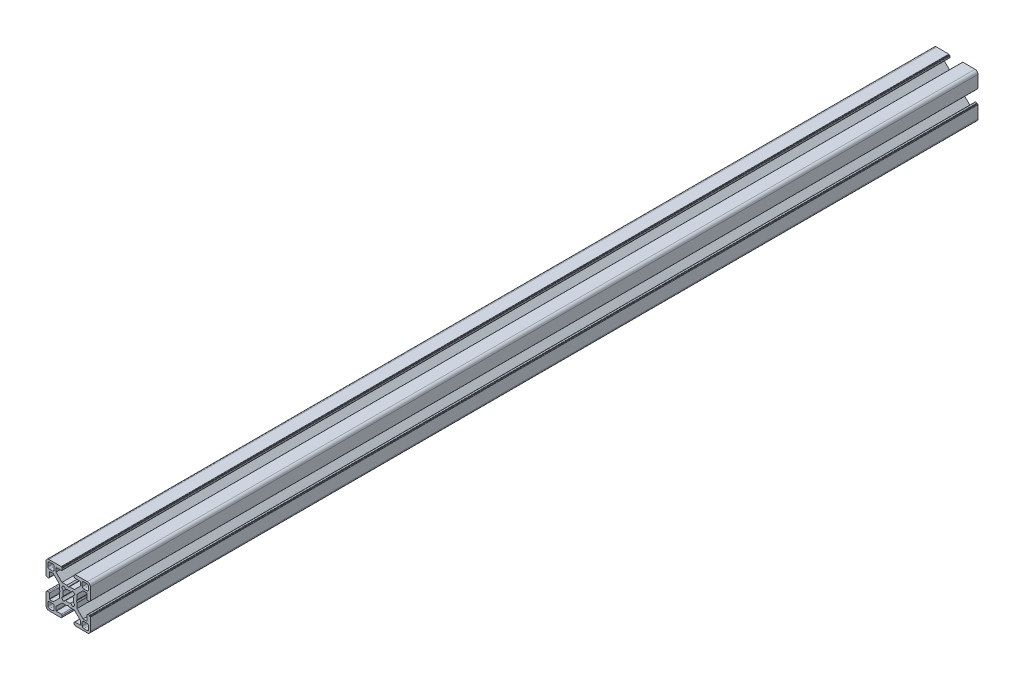
from build123d import *

# Parameters (mm, degrees)
BOSS_EXTRUDE1_DEPTH = 600
SKETCH2_R           = 3
CUT_EXTRUDE1_DEPTH  = 576.977430113


with BuildPart() as part:
    # Sketch1 → Boss-Extrude1 (new body)
    with BuildSketch(Plane.XY.offset(25)):
        with BuildLine():
            Line((-4.05, 13.399999434), (-4.05, 14.299999626))
            ThreePointArc((-4.05, 14.299999626), (-4.108578753, 14.441421247), (-4.250000374, 14.5))
            Line((-4.250000374, 14.5), (-4.350000144, 14.5))
            ThreePointArc((-4.350000144, 14.5), (-4.49142109, 14.558578474), (-4.549999564, 14.69999942))
            Line((-4.549999564, 14.69999942), (-4.549999564, 14.799999619))
            ThreePointArc((-4.549999564, 14.799999619), (-4.60857832, 14.941421245), (-4.749999945, 15))
            Line((-4.749999945, 15), (-13.000000346, 15))
            ThreePointArc((-13.000000346, 15), (-14.414213664, 14.414213664), (-15, 13.000000346))
            Line((-15, 13.000000346), (-15, 4.749999521))
            ThreePointArc((-15, 4.749999521), (-14.941421273, 4.608577964), (-14.799999716, 4.549999237))
            Line((-14.799999716, 4.549999237), (-14.700000611, 4.549999237))
            ThreePointArc((-14.700000611, 4.549999237), (-14.558579054, 4.49142051), (-14.500000327, 4.349998953))
            Line((-14.500000327, 4.349998953), (-14.500000327, 4.249999521))
            ThreePointArc((-14.500000327, 4.249999521), (-14.4414216, 4.108577964), (-14.300000043, 4.049999237))
            Line((-14.300000043, 4.049999237), (-13.39999994, 4.049999237))
            ThreePointArc((-13.39999994, 4.049999237), (-12.975735606, 4.225735278), (-12.799999564, 4.649999613))
            Line((-12.799999564, 4.649999613), (-12.799999564, 8.049999716))
            ThreePointArc((-12.799999564, 8.049999716), (-12.741420837, 8.191421273), (-12.59999928, 8.25))
            Line((-12.59999928, 8.25), (-10.049999564, 8.25))
            Line((-10.049999564, 8.25), (-6.00446543, 4.204465866))
            Line((-6.00446543, 4.204465866), (-6.00446543, 0.899999619))
            Line((-6.00446543, 0.899999619), (-5.484852164, 0))
            Line((-5.484852164, 0), (-6.00446543, -0.899999619))
            Line((-6.00446543, -0.899999619), (-6.00446543, -4.204465866))
            Line((-6.00446543, -4.204465866), (-10.049999564, -8.25))
            Line((-10.049999564, -8.25), (-12.59999928, -8.25))
            ThreePointArc((-12.59999928, -8.25), (-12.741420837, -8.191421273), (-12.799999564, -8.049999716))
            Line((-12.799999564, -8.049999716), (-12.799999564, -4.649999613))
            ThreePointArc((-12.799999564, -4.649999613), (-12.975735606, -4.225735278), (-13.39999994, -4.049999237))
            Line((-13.39999994, -4.049999237), (-14.300000043, -4.049999237))
            ThreePointArc((-14.300000043, -4.049999237), (-14.4414216, -4.108577964), (-14.500000327, -4.249999521))
            Line((-14.500000327, -4.249999521), (-14.500000327, -4.349998953))
            ThreePointArc((-14.500000327, -4.349998953), (-14.558579054, -4.49142051), (-14.700000611, -4.549999237))
            Line((-14.700000611, -4.549999237), (-14.799999716, -4.549999237))
            ThreePointArc((-14.799999716, -4.549999237), (-14.941421273, -4.608577964), (-15, -4.749999521))
            Line((-15, -4.749999521), (-15, -13.000000346))
            ThreePointArc((-15, -13.000000346), (-14.414213664, -14.414213664), (-13.000000346, -15))
            Line((-13.000000346, -15), (-4.749999945, -15))
            ThreePointArc((-4.749999945, -15), (-4.60857832, -14.941421245), (-4.549999564, -14.799999619))
            Line((-4.549999564, -14.799999619), (-4.549999564, -14.69999942))
            ThreePointArc((-4.549999564, -14.69999942), (-4.49142109, -14.558578474), (-4.350000144, -14.5))
            Line((-4.350000144, -14.5), (-4.250000374, -14.5))
            ThreePointArc((-4.250000374, -14.5), (-4.108578753, -14.441421247), (-4.05, -14.299999626))
            Line((-4.05, -14.299999626), (-4.05, -13.399999434))
            ThreePointArc((-4.05, -13.399999434), (-4.225735989, -12.975735226), (-4.650000197, -12.799999237))
            Line((-4.650000197, -12.799999237), (-8.049999924, -12.799999237))
            ThreePointArc((-8.049999924, -12.799999237), (-8.191421565, -12.741420475), (-8.250000327, -12.599998834))
            Line((-8.250000327, -12.599998834), (-8.250000327, -10.049999237))
            Line((-8.250000327, -10.049999237), (-4.204466193, -6))
            Line((-4.204466193, -6), (-0.899999946, -6))
            Line((-0.899999946, -6), (0, -5.484851837))
            Line((0, -5.484851837), (0.899999946, -6))
            Line((0.899999946, -6), (4.204466193, -6))
            Line((4.204466193, -6), (8.250000327, -10.049999237))
            Line((8.250000327, -10.049999237), (8.250000327, -12.599998834))
            ThreePointArc((8.250000327, -12.599998834), (8.191421565, -12.741420475), (8.049999924, -12.799999237))
            Line((8.049999924, -12.799999237), (4.650000197, -12.799999237))
            ThreePointArc((4.650000197, -12.799999237), (4.225735989, -12.975735226), (4.05, -13.399999434))
            Line((4.05, -13.399999434), (4.05, -14.299999626))
            ThreePointArc((4.05, -14.299999626), (4.108578753, -14.441421247), (4.250000374, -14.5))
            Line((4.250000374, -14.5), (4.350000144, -14.5))
            ThreePointArc((4.350000144, -14.5), (4.49142109, -14.558578474), (4.549999564, -14.69999942))
            Line((4.549999564, -14.69999942), (4.549999564, -14.799999619))
            ThreePointArc((4.549999564, -14.799999619), (4.60857832, -14.941421245), (4.749999945, -15))
            Line((4.749999945, -15), (13.000000346, -15))
            ThreePointArc((13.000000346, -15), (14.414213664, -14.414213664), (15, -13.000000346))
            Line((15, -13.000000346), (15, -4.749999521))
            ThreePointArc((15, -4.749999521), (14.941421273, -4.608577964), (14.799999716, -4.549999237))
            Line((14.799999716, -4.549999237), (14.700000611, -4.549999237))
            ThreePointArc((14.700000611, -4.549999237), (14.558579054, -4.49142051), (14.500000327, -4.349998953))
            Line((14.500000327, -4.349998953), (14.500000327, -4.249999521))
            ThreePointArc((14.500000327, -4.249999521), (14.4414216, -4.108577964), (14.300000043, -4.049999237))
            Line((14.300000043, -4.049999237), (13.39999994, -4.049999237))
            ThreePointArc((13.39999994, -4.049999237), (12.975735606, -4.225735278), (12.799999564, -4.649999613))
            Line((12.799999564, -4.649999613), (12.799999564, -8.049999716))
            ThreePointArc((12.799999564, -8.049999716), (12.741420837, -8.191421273), (12.59999928, -8.25))
            Line((12.59999928, -8.25), (10.049999564, -8.25))
            Line((10.049999564, -8.25), (6.00446543, -4.204465866))
            Line((6.00446543, -4.204465866), (6.00446543, -0.899999619))
            Line((6.00446543, -0.899999619), (5.484852164, 0))
            Line((5.484852164, 0), (6.00446543, 0.899999619))
            Line((6.00446543, 0.899999619), (6.00446543, 4.204465866))
            Line((6.00446543, 4.204465866), (10.049999564, 8.25))
            Line((10.049999564, 8.25), (12.59999928, 8.25))
            ThreePointArc((12.59999928, 8.25), (12.741420837, 8.191421273), (12.799999564, 8.049999716))
            Line((12.799999564, 8.049999716), (12.799999564, 4.649999613))
            ThreePointArc((12.799999564, 4.649999613), (12.975735606, 4.225735278), (13.39999994, 4.049999237))
            Line((13.39999994, 4.049999237), (14.300000043, 4.049999237))
            ThreePointArc((14.300000043, 4.049999237), (14.4414216, 4.108577964), (14.500000327, 4.249999521))
            Line((14.500000327, 4.249999521), (14.500000327, 4.349998953))
            ThreePointArc((14.500000327, 4.349998953), (14.558579054, 4.49142051), (14.700000611, 4.549999237))
            Line((14.700000611, 4.549999237), (14.799999716, 4.549999237))
            ThreePointArc((14.799999716, 4.549999237), (14.941421273, 4.608577964), (15, 4.749999521))
            Line((15, 4.749999521), (15, 13.000000346))
            ThreePointArc((15, 13.000000346), (14.414213664, 14.414213664), (13.000000346, 15))
            Line((13.000000346, 15), (4.749999945, 15))
            ThreePointArc((4.749999945, 15), (4.60857832, 14.941421245), (4.549999564, 14.799999619))
            Line((4.549999564, 14.799999619), (4.549999564, 14.69999942))
            ThreePointArc((4.549999564, 14.69999942), (4.49142109, 14.558578474), (4.350000144, 14.5))
            Line((4.350000144, 14.5), (4.250000374, 14.5))
            ThreePointArc((4.250000374, 14.5), (4.108578753, 14.441421247), (4.05, 14.299999626))
            Line((4.05, 14.299999626), (4.05, 13.399999434))
            ThreePointArc((4.05, 13.399999434), (4.225735989, 12.975735226), (4.650000197, 12.799999237))
            Line((4.650000197, 12.799999237), (8.049999924, 12.799999237))
            ThreePointArc((8.049999924, 12.799999237), (8.191421565, 12.741420475), (8.250000327, 12.599998834))
            Line((8.250000327, 12.599998834), (8.250000327, 10.049999237))
            Line((8.250000327, 10.049999237), (4.204466193, 6))
            Line((4.204466193, 6), (0.899999946, 6))
            Line((0.899999946, 6), (0, 5.484851837))
            Line((0, 5.484851837), (-0.899999946, 6))
            Line((-0.899999946, 6), (-4.204466193, 6))
            Line((-4.204466193, 6), (-8.250000327, 10.049999237))
            Line((-8.250000327, 10.049999237), (-8.250000327, 12.599998834))
            ThreePointArc((-8.250000327, 12.599998834), (-8.191421565, 12.741420475), (-8.049999924, 12.799999237))
            Line((-8.049999924, 12.799999237), (-4.650000197, 12.799999237))
            ThreePointArc((-4.650000197, 12.799999237), (-4.225735989, 12.975735226), (-4.05, 13.399999434))
        make_face()
        with BuildLine():
            Line((-12.7000011, 13.700000398), (-10.500000318, 13.700000398))
            ThreePointArc((-10.500000318, 13.700000398), (-9.792893543, 13.407107182), (-9.500000327, 12.700000408))
            Line((-9.500000327, 12.700000408), (-9.500000327, 10.499999626))
            ThreePointArc((-9.500000327, 10.499999626), (-9.792893543, 9.792892851), (-10.500000318, 9.499999635))
            Line((-10.500000318, 9.499999635), (-12.7000011, 9.499999635))
            ThreePointArc((-12.7000011, 9.499999635), (-13.407107874, 9.792892851), (-13.70000109, 10.499999626))
            Line((-13.70000109, 10.499999626), (-13.70000109, 12.700000408))
            ThreePointArc((-13.70000109, 12.700000408), (-13.407107874, 13.407107182), (-12.7000011, 13.700000398))
        make_face(mode=Mode.SUBTRACT)
        with BuildLine():
            Line((-10.500000318, -13.700000398), (-12.7000011, -13.700000398))
            ThreePointArc((-12.7000011, -13.700000398), (-13.407107874, -13.407107182), (-13.70000109, -12.700000408))
            Line((-13.70000109, -12.700000408), (-13.70000109, -10.499999626))
            ThreePointArc((-13.70000109, -10.499999626), (-13.407107874, -9.792892851), (-12.7000011, -9.499999635))
            Line((-12.7000011, -9.499999635), (-10.500000318, -9.499999635))
            ThreePointArc((-10.500000318, -9.499999635), (-9.792893543, -9.792892851), (-9.500000327, -10.499999626))
            Line((-9.500000327, -10.499999626), (-9.500000327, -12.700000408))
            ThreePointArc((-9.500000327, -12.700000408), (-9.792893543, -13.407107182), (-10.500000318, -13.700000398))
        make_face(mode=Mode.SUBTRACT)
        with BuildLine():
            Line((10.500000318, 13.700000398), (12.7000011, 13.700000398))
            ThreePointArc((12.7000011, 13.700000398), (13.407107874, 13.407107182), (13.70000109, 12.700000408))
            Line((13.70000109, 12.700000408), (13.70000109, 10.499999626))
            ThreePointArc((13.70000109, 10.499999626), (13.407107874, 9.792892851), (12.7000011, 9.499999635))
            Line((12.7000011, 9.499999635), (10.500000318, 9.499999635))
            ThreePointArc((10.500000318, 9.499999635), (9.792893543, 9.792892851), (9.500000327, 10.499999626))
            Line((9.500000327, 10.499999626), (9.500000327, 12.700000408))
            ThreePointArc((9.500000327, 12.700000408), (9.792893543, 13.407107182), (10.500000318, 13.700000398))
        make_face(mode=Mode.SUBTRACT)
        with BuildLine():
            Line((13.70000109, -10.499999626), (13.70000109, -12.700000408))
            ThreePointArc((13.70000109, -12.700000408), (13.407107874, -13.407107182), (12.7000011, -13.700000398))
            Line((12.7000011, -13.700000398), (10.500000318, -13.700000398))
            ThreePointArc((10.500000318, -13.700000398), (9.792893543, -13.407107182), (9.500000327, -12.700000408))
            Line((9.500000327, -12.700000408), (9.500000327, -10.499999626))
            ThreePointArc((9.500000327, -10.499999626), (9.792893543, -9.792892851), (10.500000318, -9.499999635))
            Line((10.500000318, -9.499999635), (12.7000011, -9.499999635))
            ThreePointArc((12.7000011, -9.499999635), (13.407107874, -9.792892851), (13.70000109, -10.499999626))
        make_face(mode=Mode.SUBTRACT)
        with BuildLine():
            Line((-3.135929412, 4.518400903), (-1.600129524, 3.280561767))
            ThreePointArc((-1.600129524, 3.280561767), (0, 3.65), (1.600129524, 3.280561767))
            Line((1.600129524, 3.280561767), (3.135929412, 4.518400903))
            ThreePointArc((3.135929412, 4.518400903), (3.881002259, 3.897155561), (4.505336892, 3.154669473))
            Line((4.505336892, 3.154669473), (3.280561732, 1.600129597))
            ThreePointArc((3.280561732, 1.600129597), (3.65, 0), (3.280561732, -1.600129597))
            Line((3.280561732, -1.600129597), (4.505336892, -3.154669473))
            ThreePointArc((4.505336892, -3.154669473), (3.881002259, -3.897155561), (3.135929412, -4.518400903))
            Line((3.135929412, -4.518400903), (1.600129524, -3.280561767))
            ThreePointArc((1.600129524, -3.280561767), (0, -3.65), (-1.600129524, -3.280561767))
            Line((-1.600129524, -3.280561767), (-3.135929412, -4.518400903))
            ThreePointArc((-3.135929412, -4.518400903), (-3.881002259, -3.897155561), (-4.505336892, -3.154669473))
            Line((-4.505336892, -3.154669473), (-3.280561732, -1.600129597))
            ThreePointArc((-3.280561732, -1.600129597), (-3.65, 0), (-3.280561732, 1.600129597))
            Line((-3.280561732, 1.600129597), (-4.505336892, 3.154669473))
            ThreePointArc((-4.505336892, 3.154669473), (-3.881002259, 3.897155561), (-3.135929412, 4.518400903))
        make_face(mode=Mode.SUBTRACT)
    extrude(amount=-BOSS_EXTRUDE1_DEPTH)

    # Sketch2 → Cut-Extrude1 (cut, through all)
    with BuildSketch(Plane(origin=(15, 0, 0), x_dir=(0, 0, -1), z_dir=(1, 0, 0))):
        with Locations(Location((49, 0, 0), (0, 0, 147.76609808))):
            Circle(SKETCH2_R)
        with Locations(Location((501, 0, 0), (0, 0, 147.76609808))):
            Circle(SKETCH2_R)
    extrude(amount=-CUT_EXTRUDE1_DEPTH, mode=Mode.SUBTRACT)


solid = part.part
